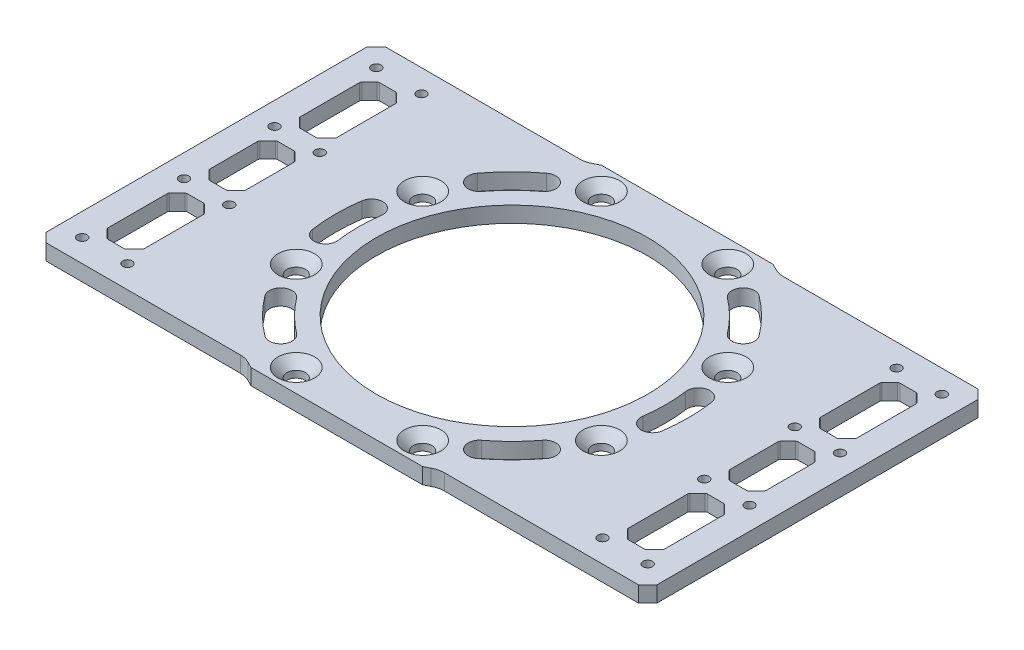
from build123d import *

# Parameters (mm, degrees)
SKETCH_1_W          = 270
SKETCH_1_H          = 154.886411746
SKETCH_1_R          = 4.1
SKETCH_1_R_2        = 60
SKETCH_1_R_3        = 2.1
EXTRUDE_1_DEPTH     = 3.5
CUT_EXTRUDE_1_DEPTH = 156.792972036
CHAMFER_1_SIZE      = 4
FILLET_1_R          = 10
SKETCH_3_W          = 16
SKETCH_3_H          = 35
SKETCH_3_H_2        = 30
CUT_EXTRUDE_2_DEPTH = 156.792972036
CHAMFER_2_SIZE      = 4
FILLET_2_R          = 1
CUT_EXTRUDE_3_DEPTH = 7


with BuildPart() as part:
    # 草图1 → 凸台-拉伸1 (new, symmetric)
    with BuildSketch(Plane(origin=(0, 0, 0), x_dir=(1, 0, 0), z_dir=(0, 1, 0))):
        Rectangle(SKETCH_1_W, SKETCH_1_H)
        with Locations(Location((-67.443205873, -27.935890563, 0), (0, 0, 270))):
            Circle(SKETCH_1_R, mode=Mode.SUBTRACT)
        with Locations(Location((-67.443205873, 27.935890563, 0), (0, 0, 270))):
            Circle(SKETCH_1_R, mode=Mode.SUBTRACT)
        with Locations(Location((-27.935890563, 67.443205873, 0), (0, 0, 270))):
            Circle(SKETCH_1_R, mode=Mode.SUBTRACT)
        with Locations(Location((27.935890563, 67.443205873, 0), (0, 0, 270))):
            Circle(SKETCH_1_R, mode=Mode.SUBTRACT)
        with Locations(Location((67.443205873, 27.935890563, 0), (0, 0, 270))):
            Circle(SKETCH_1_R, mode=Mode.SUBTRACT)
        with Locations(Location((67.443205873, -27.935890563, 0), (0, 0, 270))):
            Circle(SKETCH_1_R, mode=Mode.SUBTRACT)
        with Locations(Location((27.935890563, -67.443205873, 0), (0, 0, 270))):
            Circle(SKETCH_1_R, mode=Mode.SUBTRACT)
        with Locations(Location((-27.935890563, -67.443205873, 0), (0, 0, 270))):
            Circle(SKETCH_1_R, mode=Mode.SUBTRACT)
        with Locations(Location((0, 0, 0), (0, 0, 270))):
            Circle(SKETCH_1_R_2, mode=Mode.SUBTRACT)
        with Locations(Location((-125, 65, 0), (0, 0, 270))):
            Circle(SKETCH_1_R_3, mode=Mode.SUBTRACT)
        with Locations(Location((-105, 65, 0), (0, 0, 270))):
            Circle(SKETCH_1_R_3, mode=Mode.SUBTRACT)
        with Locations(Location((-125, -65, 0), (0, 0, 270))):
            Circle(SKETCH_1_R_3, mode=Mode.SUBTRACT)
        with Locations(Location((-105, -65, 0), (0, 0, 270))):
            Circle(SKETCH_1_R_3, mode=Mode.SUBTRACT)
        with Locations(Location((-125, 20, 0), (0, 0, 270))):
            Circle(SKETCH_1_R_3, mode=Mode.SUBTRACT)
        with Locations(Location((-105, 20, 0), (0, 0, 270))):
            Circle(SKETCH_1_R_3, mode=Mode.SUBTRACT)
        with Locations(Location((-125, -20, 0), (0, 0, 270))):
            Circle(SKETCH_1_R_3, mode=Mode.SUBTRACT)
        with Locations(Location((-105, -20, 0), (0, 0, 270))):
            Circle(SKETCH_1_R_3, mode=Mode.SUBTRACT)
        with Locations(Location((105, -65, 0), (0, 0, 90))):
            Circle(SKETCH_1_R_3, mode=Mode.SUBTRACT)
        with Locations(Location((125, -65, 0), (0, 0, 90))):
            Circle(SKETCH_1_R_3, mode=Mode.SUBTRACT)
        with Locations(Location((105, -20, 0), (0, 0, 90))):
            Circle(SKETCH_1_R_3, mode=Mode.SUBTRACT)
        with Locations(Location((125, -20, 0), (0, 0, 90))):
            Circle(SKETCH_1_R_3, mode=Mode.SUBTRACT)
        with Locations(Location((105, 20, 0), (0, 0, 90))):
            Circle(SKETCH_1_R_3, mode=Mode.SUBTRACT)
        with Locations(Location((125, 20, 0), (0, 0, 90))):
            Circle(SKETCH_1_R_3, mode=Mode.SUBTRACT)
        with Locations(Location((105, 65, 0), (0, 0, 90))):
            Circle(SKETCH_1_R_3, mode=Mode.SUBTRACT)
        with Locations(Location((125, 65, 0), (0, 0, 90))):
            Circle(SKETCH_1_R_3, mode=Mode.SUBTRACT)
    extrude(amount=EXTRUDE_1_DEPTH, both=True)

    # 草图2 → 切除-拉伸1 (cut, through all)
    with BuildSketch(Plane(origin=(0, 3.5, 0), x_dir=(1, 0, 0), z_dir=(0, 1, 0))):
        with BuildLine():
            Line((-135, 75), (-42.562682349, 75))
            ThreePointArc((-42.562682349, 75), (-40.267820576, 76.256701704), (-37.935890563, 77.443205873))
            Line((-37.935890563, 77.443205873), (-135, 77.443205873))
            Line((-135, 77.443205873), (-135, 75))
        make_face()
        with BuildLine():
            Line((135, 77.443205873), (135, 75))
            Line((135, 75), (42.562682349, 75))
            ThreePointArc((42.562682349, 75), (40.267820576, 76.256701704), (37.935890563, 77.443205873))
            Line((37.935890563, 77.443205873), (135, 77.443205873))
        make_face()
        with BuildLine():
            Line((135, -75), (42.562682349, -75))
            ThreePointArc((42.562682349, -75), (40.267820576, -76.256701704), (37.935890563, -77.443205873))
            Line((37.935890563, -77.443205873), (135, -77.443205873))
            Line((135, -77.443205873), (135, -75))
        make_face()
        with BuildLine():
            Line((-135, -77.443205873), (-135, -75))
            Line((-135, -75), (-42.562682349, -75))
            ThreePointArc((-42.562682349, -75), (-40.267820576, -76.256701704), (-37.935890563, -77.443205873))
            Line((-37.935890563, -77.443205873), (-135, -77.443205873))
        make_face()
    extrude(amount=-CUT_EXTRUDE_1_DEPTH, mode=Mode.SUBTRACT)

    # 倒角1
    chamfer_1_edges = [part.edges().sort_by_distance(p)[0] for p in [
        (-67.443205873, 3.5, 23.835890563),
        (-135, 0, 75),
        (135, 0, 75),
        (135, 0, -75),
        (-135, 0, -75),
        (-67.443205873, 3.5, -32.035890563),
        (-27.935890563, 3.5, -71.543205873),
        (27.935890563, 3.5, -71.543205873),
        (67.443205873, 3.5, -32.035890563),
        (67.443205873, 3.5, 23.835890563),
        (27.935890563, 3.5, 63.343205873),
        (-27.935890563, 3.5, 63.343205873),
    ]]
    chamfer(chamfer_1_edges, length=CHAMFER_1_SIZE)

    # 圆角1
    fillet_1_edges = [part.edges().sort_by_distance(p)[0] for p in [
        (-42.562682349, 0, 75),
        (42.562682349, 0, 75),
        (42.562682349, 0, -75),
        (-42.562682349, 0, -75),
    ]]
    fillet(fillet_1_edges, radius=FILLET_1_R)

    # 草图3 → 切除-拉伸2 (cut, through all)
    with BuildSketch(Plane(origin=(0, 3.5, 0), x_dir=(1, 0, 0), z_dir=(0, 1, 0))):
        with Locations((-115, 42.5)):
            Rectangle(SKETCH_3_W, SKETCH_3_H)
        with Locations((-115, 0)):
            Rectangle(SKETCH_3_W, SKETCH_3_H_2)
        with Locations((-115, -42.5)):
            Rectangle(SKETCH_3_W, SKETCH_3_H)
        with Locations((115, -42.5)):
            Rectangle(SKETCH_3_W, SKETCH_3_H)
        with Locations((115, 0)):
            Rectangle(SKETCH_3_W, SKETCH_3_H_2)
        with Locations((115, 42.5)):
            Rectangle(SKETCH_3_W, SKETCH_3_H)
    extrude(amount=-CUT_EXTRUDE_2_DEPTH, mode=Mode.SUBTRACT)

    # 倒角2
    chamfer_2_edges = [part.edges().sort_by_distance(p)[0] for p in [
        (107, 0, -25),
        (107, 0, -60),
        (123, 0, -60),
        (123, 0, -25),
        (107, 0, 15),
        (107, 0, -15),
        (123, 0, -15),
        (123, 0, 15),
        (107, 0, 60),
        (107, 0, 25),
        (123, 0, 25),
        (123, 0, 60),
        (-123, 0, 60),
        (-123, 0, 25),
        (-107, 0, 25),
        (-107, 0, 60),
        (-123, 0, 15),
        (-123, 0, -15),
        (-107, 0, -15),
        (-107, 0, 15),
        (-123, 0, -25),
        (-123, 0, -60),
        (-107, 0, -60),
        (-107, 0, -25),
    ]]
    chamfer(chamfer_2_edges, length=CHAMFER_2_SIZE)

    # 圆角2
    fillet_2_edges = [part.edges().sort_by_distance(p)[0] for p in [
        (107, 0, -29),
        (107, 0, -56),
        (119, 0, -60),
        (111, 0, -60),
        (123, 0, -29),
        (123, 0, -56),
        (119, 0, -25),
        (111, 0, -25),
        (107, 0, 11),
        (107, 0, -11),
        (119, 0, -15),
        (111, 0, -15),
        (119, 0, 15),
        (111, 0, 15),
        (123, 0, -11),
        (123, 0, 11),
        (107, 0, 56),
        (107, 0, 29),
        (119, 0, 25),
        (111, 0, 25),
        (123, 0, 56),
        (123, 0, 29),
        (111, 0, 60),
        (119, 0, 60),
        (-111, 0, 60),
        (-119, 0, 60),
        (-123, 0, 29),
        (-123, 0, 56),
        (-107, 0, 29),
        (-107, 0, 56),
        (-119, 0, 25),
        (-111, 0, 25),
        (-111, 0, 15),
        (-119, 0, 15),
        (-123, 0, -11),
        (-123, 0, 11),
        (-107, 0, -11),
        (-107, 0, 11),
        (-119, 0, -15),
        (-111, 0, -15),
        (-111, 0, -25),
        (-119, 0, -25),
        (-123, 0, -56),
        (-123, 0, -29),
        (-107, 0, -56),
        (-107, 0, -29),
        (-119, 0, -60),
        (-111, 0, -60),
    ]]
    fillet(fillet_2_edges, radius=FILLET_2_R)

    # 草图4 → 切除-拉伸3 (cut)
    with BuildSketch(Plane(origin=(0, 3.5, 0), x_dir=(1, 0, 0), z_dir=(0, 1, 0))):
        with BuildLine():
            ThreePointArc((-77.240909362, 10.855501875), (-78, 0), (-77.240909362, -10.855501875))
            ThreePointArc((-77.240909362, -10.855501875), (-71.593703513, -15.110976714), (-67.338228674, -9.463770865))
            ThreePointArc((-67.338228674, -9.463770865), (-68, 0), (-67.338228674, 9.463770865))
            ThreePointArc((-67.338228674, 9.463770865), (-71.593703513, 15.110976714), (-77.240909362, 10.855501875))
        make_face()
        with BuildLine():
            ThreePointArc((-46.941571806, 62.293569784), (-55.154328933, 55.154328933), (-62.293569784, 46.941571806))
            ThreePointArc((-62.293569784, 46.941571806), (-61.309467349, 39.93931914), (-54.307214683, 40.923421574))
            ThreePointArc((-54.307214683, 40.923421574), (-48.083261121, 48.083261121), (-40.923421574, 54.307214683))
            ThreePointArc((-40.923421574, 54.307214683), (-39.93931914, 61.309467349), (-46.941571806, 62.293569784))
        make_face()
        with BuildLine():
            ThreePointArc((62.293569784, 46.941571806), (55.154328933, 55.154328933), (46.941571806, 62.293569784))
            ThreePointArc((46.941571806, 62.293569784), (39.93931914, 61.309467349), (40.923421574, 54.307214683))
            ThreePointArc((40.923421574, 54.307214683), (48.083261121, 48.083261121), (54.307214683, 40.923421574))
            ThreePointArc((54.307214683, 40.923421574), (61.309467349, 39.93931914), (62.293569784, 46.941571806))
        make_face()
        with BuildLine():
            ThreePointArc((77.240909362, -10.855501875), (78, 0), (77.240909362, 10.855501875))
            ThreePointArc((77.240909362, 10.855501875), (71.593703513, 15.110976714), (67.338228674, 9.463770865))
            ThreePointArc((67.338228674, 9.463770865), (68, 0), (67.338228674, -9.463770865))
            ThreePointArc((67.338228674, -9.463770865), (71.593703513, -15.110976714), (77.240909362, -10.855501875))
        make_face()
        with BuildLine():
            ThreePointArc((46.941571806, -62.293569784), (55.154328933, -55.154328933), (62.293569784, -46.941571806))
            ThreePointArc((62.293569784, -46.941571806), (61.309467349, -39.93931914), (54.307214683, -40.923421574))
            ThreePointArc((54.307214683, -40.923421574), (48.083261121, -48.083261121), (40.923421574, -54.307214683))
            ThreePointArc((40.923421574, -54.307214683), (39.93931914, -61.309467349), (46.941571806, -62.293569784))
        make_face()
        with BuildLine():
            ThreePointArc((-62.293569784, -46.941571806), (-55.154328933, -55.154328933), (-46.941571806, -62.293569784))
            ThreePointArc((-46.941571806, -62.293569784), (-39.93931914, -61.309467349), (-40.923421574, -54.307214683))
            ThreePointArc((-40.923421574, -54.307214683), (-48.083261121, -48.083261121), (-54.307214683, -40.923421574))
            ThreePointArc((-54.307214683, -40.923421574), (-61.309467349, -39.93931914), (-62.293569784, -46.941571806))
        make_face()
    extrude(amount=-CUT_EXTRUDE_3_DEPTH, mode=Mode.SUBTRACT)


solid = part.part
